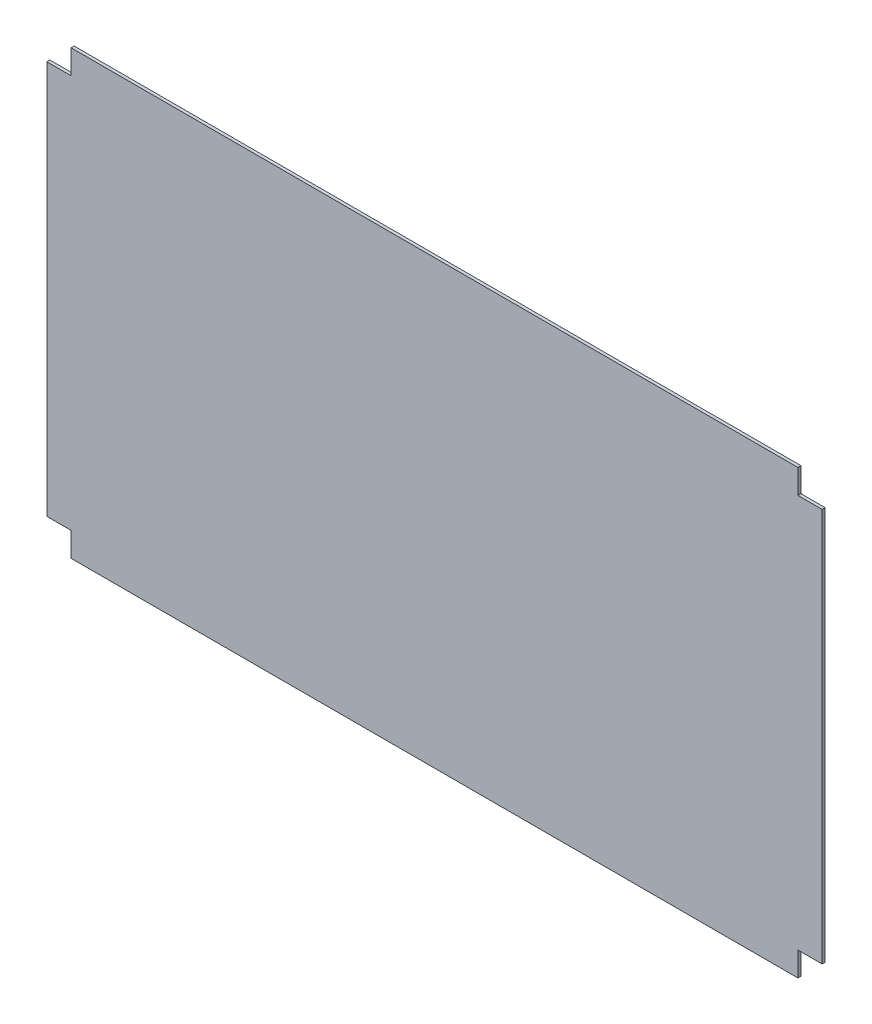
from build123d import *

# Parameters (mm, degrees)
BOSS_EXTRU_1_DEPTH = 5


with BuildPart() as part:
    # Esquisse1 → Boss.-Extru.1 (new body)
    with BuildSketch(Plane.XY):
        Polygon((1240, 0), (40, 0), (40, -40), (0, -40), (0, -690), (40, -690), (40, -730), (1240, -730), (1240, -690), (1280, -690), (1280, -40), (1240, -40), align=None)
    extrude(amount=BOSS_EXTRU_1_DEPTH)


solid = part.part
